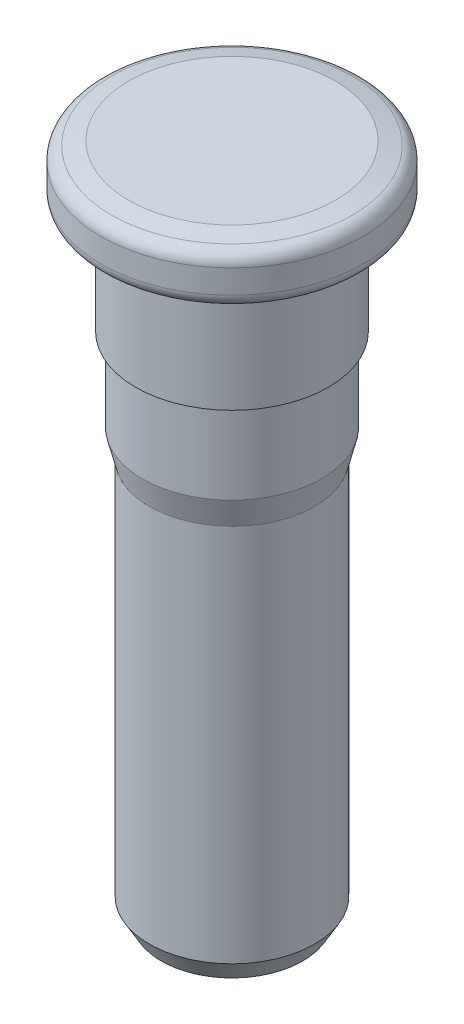
from build123d import *

# Parameters (mm, degrees)
FILETE1_R      = 1
FILETE2_R      = 1
CHANFRO1_SIZE  = 1.5
CHANFRO1_SIZE2 = 0.866025404


with BuildPart() as part:
    # Esboço1 → Revolução1 (revolve)
    with BuildSketch(Plane.XY, mode=Mode.PRIVATE) as revolu_o1_sk:
        Polygon((0, 44.337029737), (7.5, 44.337029737), (9.5, 43.837029737), (9.5, 40.337029737), (7, 40.337029737), (7, 32.337029737), (6.5, 32.337029737), (6.5, 26.337029737), (6, 24.337029737), (6, -4.662970263), (0, -4.662970263), align=None)
    revolve(revolu_o1_sk.sketch.rotate(Axis((0, -66.826190476, 0), (0, 1, 0)), 90), axis=Axis((0, -66.826190476, 0), (0, 1, 0)))

    # Filete1
    filete1_edges = [part.edges().sort_by_distance(p)[0] for p in [
        (0, 43.837029737, 9.5),
    ]]
    fillet(filete1_edges, radius=FILETE1_R)

    # Filete2
    filete2_edges = [part.edges().sort_by_distance(p)[0] for p in [
        (0, 40.337029737, 9.5),
    ]]
    fillet(filete2_edges, radius=FILETE2_R)

    # Chanfro1
    chanfro1_edges = [part.edges().sort_by_distance(p)[0] for p in [
        (0, -4.662970263, 6),
    ]]
    chanfro1_side = [part.faces().sort_by_distance(p)[0] for p in [
        (0, 9.837029737, 6),
    ]]
    chamfer(chanfro1_edges, length=CHANFRO1_SIZE, length2=CHANFRO1_SIZE2, reference=chanfro1_side[0])


solid = part.part
